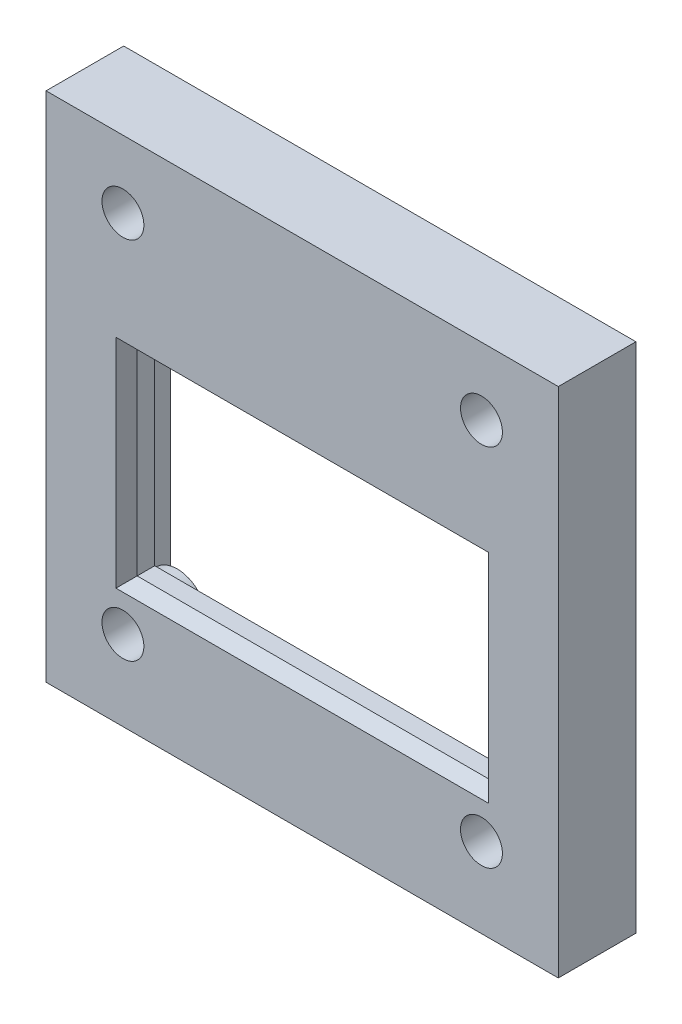
from build123d import *

# Parameters (mm, degrees)
SKETCH1_W           = 33
SKETCH1_H           = 33
SKETCH1_W_2         = 23
SKETCH1_H_2         = 13
BOSS_EXTRUDE1_DEPTH = 2
CHAMFER1_SIZE       = 0.5
CHAMFER1_SIZE2      = 0.866025404
SKETCH2_W           = 33
SKETCH2_H           = 33
SKETCH2_W_2         = 27
SKETCH2_H_2         = 28.15
BOSS_EXTRUDE2_DEPTH = 3
CUT_EXTRUDE2_DEPTH  = 3
SKETCH4_R           = 1.9
SKETCH4_R_2         = 1.1
BOSS_EXTRUDE3_DEPTH = 1.5
CUT_EXTRUDE3_START  = -10
SKETCH5_R           = 1.35
CUT_EXTRUDE3_DEPTH  = 10
SKETCH6_W           = 15
SKETCH6_H           = 1.5
CUT_EXTRUDE4_DEPTH  = 3


with BuildPart() as part:
    # Sketch1 → Boss-Extrude1 (new body)
    with BuildSketch(Plane.XY):
        with Locations((-0.6, 1.925)):
            Rectangle(SKETCH1_W, SKETCH1_H)
        with Locations((-0.6, -0.075)):
            Rectangle(SKETCH1_W_2, SKETCH1_H_2, mode=Mode.SUBTRACT)
    extrude(amount=BOSS_EXTRUDE1_DEPTH)

    # Chamfer1
    chamfer1_edges = [part.edges().sort_by_distance(p)[0] for p in [
        (-12.1, -0.075, 2),
        (-0.6, -6.575, 2),
        (10.9, -0.075, 2),
        (-0.6, 6.425, 2),
    ]]
    chamfer1_side = [part.faces().sort_by_distance(p)[0] for p in [
        (-0.6, -14.108309524, 2),
    ]]
    chamfer(chamfer1_edges, length=CHAMFER1_SIZE, length2=CHAMFER1_SIZE2, reference=chamfer1_side[0])

    # Sketch2 → Boss-Extrude2 (add)
    with BuildSketch(Plane(origin=(0, 0, 0), x_dir=(-1, 0, 0), z_dir=(0, 0, -1))):
        with Locations((0.6, 1.925)):
            Rectangle(SKETCH2_W, SKETCH2_H)
        with Locations((0.6, 2)):
            Rectangle(SKETCH2_W_2, SKETCH2_H_2, mode=Mode.SUBTRACT)
    extrude(amount=BOSS_EXTRUDE2_DEPTH)

    # Sketch3 → Cut-Extrude2 (cut)
    with BuildSketch(Plane(origin=(0, 0, 0), x_dir=(-1, 0, 0), z_dir=(0, 0, -1))):
        with BuildLine():
            Line((-10.95, 12.725), (-10.95, 14.075))
            Line((-10.95, 14.075), (-9.6, 14.075))
            ThreePointArc((-9.6, 14.075), (-11.904594155, 15.029594155), (-10.95, 12.725))
        make_face()
        with BuildLine():
            Line((-9.6, 14.075), (-10.95, 14.075))
            Line((-10.95, 14.075), (-10.95, 12.725))
            ThreePointArc((-10.95, 12.725), (-9.995405845, 13.120405845), (-9.6, 14.075))
        make_face()
        with BuildLine():
            ThreePointArc((13.5, 14.075), (12.15, 15.425), (10.8, 14.075))
            Line((10.8, 14.075), (12.15, 14.075))
            Line((12.15, 14.075), (12.15, 12.725))
            ThreePointArc((12.15, 12.725), (13.104594155, 13.120405845), (13.5, 14.075))
        make_face()
        with BuildLine():
            Line((12.15, 14.075), (10.8, 14.075))
            ThreePointArc((10.8, 14.075), (11.195405845, 13.120405845), (12.15, 12.725))
            Line((12.15, 12.725), (12.15, 14.075))
        make_face()
        with BuildLine():
            ThreePointArc((13.5, -9.425), (13.104594155, -8.470405845), (12.15, -8.075))
            Line((12.15, -8.075), (12.15, -9.425))
            Line((12.15, -9.425), (10.8, -9.425))
            ThreePointArc((10.8, -9.425), (12.15, -10.775), (13.5, -9.425))
        make_face()
        with BuildLine():
            Line((12.15, -9.425), (12.15, -8.075))
            ThreePointArc((12.15, -8.075), (11.195405845, -8.470405845), (10.8, -9.425))
            Line((10.8, -9.425), (12.15, -9.425))
        make_face()
        with BuildLine():
            ThreePointArc((-9.6, -9.425), (-9.995405845, -8.470405845), (-10.95, -8.075))
            Line((-10.95, -8.075), (-10.95, -9.425))
            Line((-10.95, -9.425), (-9.6, -9.425))
        make_face()
        with BuildLine():
            Line((-10.95, -9.425), (-10.95, -8.075))
            ThreePointArc((-10.95, -8.075), (-11.904594155, -10.379594155), (-9.6, -9.425))
            Line((-9.6, -9.425), (-10.95, -9.425))
        make_face()
    extrude(amount=-CUT_EXTRUDE2_DEPTH, mode=Mode.SUBTRACT)

    # Sketch4 → Boss-Extrude3 (add)
    # profile 1 of 4: a face of its own
    with BuildSketch(Plane(origin=(0, 0, 0), x_dir=(-1, 0, 0), z_dir=(0, 0, -1))):
        with Locations((-10.95, 14.075)):
            Circle(SKETCH4_R)
        with Locations((-10.95, 14.075)):
            Circle(SKETCH4_R_2, mode=Mode.SUBTRACT)
    # profile 2 of 4: a face of its own
    with BuildSketch(Plane(origin=(0, 0, 0), x_dir=(-1, 0, 0), z_dir=(0, 0, -1))):
        with Locations((12.15, 14.075)):
            Circle(SKETCH4_R)
        with Locations((12.15, 14.075)):
            Circle(SKETCH4_R_2, mode=Mode.SUBTRACT)
    # profile 3 of 4: a face of its own
    with BuildSketch(Plane(origin=(0, 0, 0), x_dir=(-1, 0, 0), z_dir=(0, 0, -1))):
        with Locations((-10.95, -9.425)):
            Circle(SKETCH4_R)
        with Locations((-10.95, -9.425)):
            Circle(SKETCH4_R_2, mode=Mode.SUBTRACT)
    # profile 4 of 4: a face of its own
    with BuildSketch(Plane(origin=(0, 0, 0), x_dir=(-1, 0, 0), z_dir=(0, 0, -1))):
        with Locations((12.15, -9.425)):
            Circle(SKETCH4_R)
        with Locations((12.15, -9.425)):
            Circle(SKETCH4_R_2, mode=Mode.SUBTRACT)
    extrude(amount=BOSS_EXTRUDE3_DEPTH)

    # Sketch5 → Cut-Extrude3 (cut)
    with BuildSketch(Plane.XY.offset(2).offset(CUT_EXTRUDE3_START)):
        with Locations(Location((-12.15, 14.075, 0), (0, 0, 180))):
            Circle(SKETCH5_R)
        with Locations(Location((10.95, 14.075, 0), (0, 0, 180))):
            Circle(SKETCH5_R)
        with Locations(Location((-12.15, -9.425, 0), (0, 0, 180))):
            Circle(SKETCH5_R)
        with Locations(Location((10.95, -9.425, 0), (0, 0, 180))):
            Circle(SKETCH5_R)
    extrude(amount=CUT_EXTRUDE3_DEPTH, mode=Mode.SUBTRACT)

    # Sketch6 → Cut-Extrude4 (cut)
    with BuildSketch(Plane(origin=(0, 0, -3), x_dir=(-1, 0, 0), z_dir=(0, 0, -1))):
        with Locations((0.6, -12.825)):
            Rectangle(SKETCH6_W, SKETCH6_H)
    extrude(amount=-CUT_EXTRUDE4_DEPTH, mode=Mode.SUBTRACT)


solid = part.part
